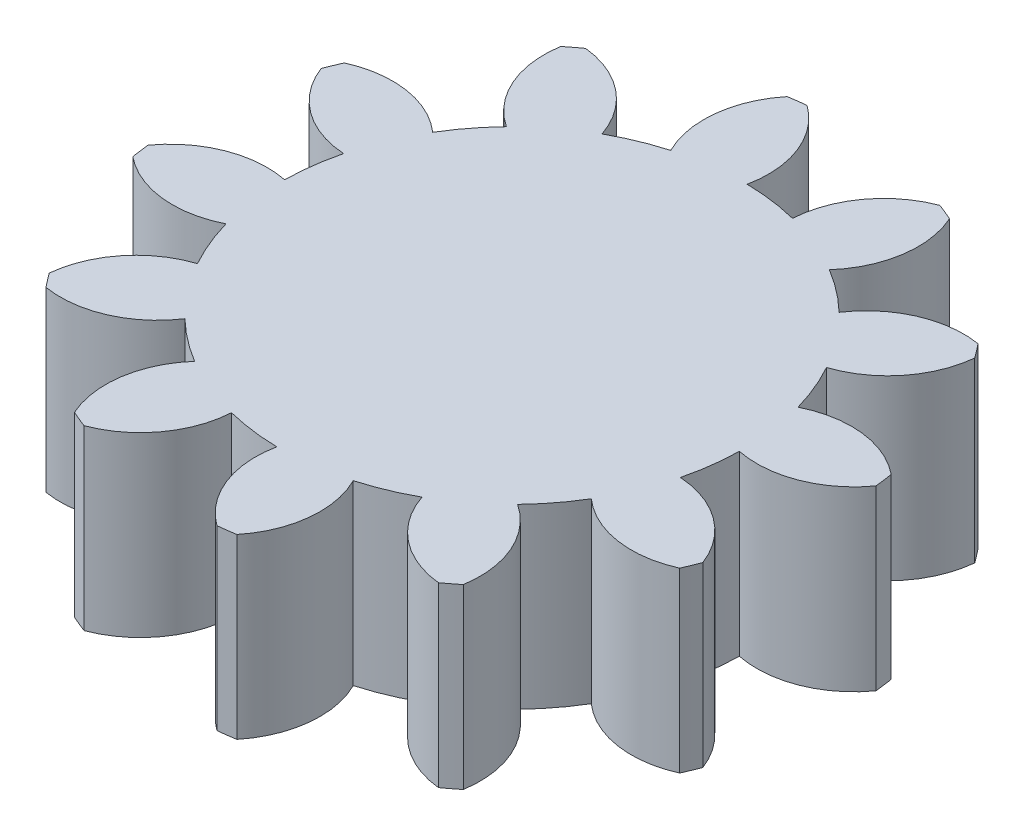
from build123d import *

# Parameters (mm, degrees)
SKETCH1_R                 = 5.6
BOSS_EXTRUDE1_DEPTH       = 3
CUT_EXTRUDE1_START        = -3
CUT_EXTRUDE1_DEPTH        = 3
CIRPATTERN1_COUNT         = 12
CIRPATTERN1_START         = -3
CIRPATTERN1_COPY_1_DEPTH  = 3
CIRPATTERN1_COPY_2_DEPTH  = 3
CIRPATTERN1_COPY_3_DEPTH  = 3
CIRPATTERN1_COPY_4_DEPTH  = 3
CIRPATTERN1_COPY_5_DEPTH  = 3
CIRPATTERN1_COPY_6_DEPTH  = 3
CIRPATTERN1_COPY_7_DEPTH  = 3
CIRPATTERN1_COPY_8_DEPTH  = 3
CIRPATTERN1_COPY_9_DEPTH  = 3
CIRPATTERN1_COPY_10_DEPTH = 3
CIRPATTERN1_COPY_11_DEPTH = 3


with BuildPart() as part:
    # Sketch1 → Boss-Extrude1 (new body)
    with BuildSketch(Plane(origin=(0, 0, 0), x_dir=(1, 0, 0), z_dir=(0, 1, 0))):
        with Locations(Location((0, 0, 0), (0, 0, 270))):
            Circle(SKETCH1_R)
    extrude(amount=BOSS_EXTRUDE1_DEPTH)

    # Sketch2 → Cut-Extrude1 (cut)
    with BuildSketch(Plane(origin=(0, 3, 0), x_dir=(1, 0, 0), z_dir=(0, 1, 0)).offset(CUT_EXTRUDE1_START)):
        with BuildLine():
            Line((0.510357412, 3.876549408), (0.730946676, 5.552091224))
            ThreePointArc((0.730946676, 5.552091224), (0.075009446, 5.599497619), (-0.581962275, 5.569678618))
            ThreePointArc((-0.581962275, 5.569678618), (-0.013232679, 4.835071359), (0.066186197, 3.909439779))
            ThreePointArc((0.066186197, 3.909439779), (0.288740502, 3.899324162), (0.510357412, 3.876549408))
        make_face()
    cut_extrude1 = extrude(amount=CUT_EXTRUDE1_DEPTH, mode=Mode.SUBTRACT)

    # Mirror1: Cut-Extrude1 across plane
    add(cut_extrude1.mirror(Plane(origin=(0, 0, 0), x_dir=(-0.13052619222004483, 0, 0.9914448613738113), z_dir=(-0.9914448613738114, 0, -0.13052619222004483))), mode=Mode.SUBTRACT)

    # CirPattern1: Cut-Extrude1 ×12 about axis
    cirpattern1_axis = Axis((0, 0, 0), (0, 1, 0))
    for i in range(1, CIRPATTERN1_COUNT):
        add(cut_extrude1.rotate(cirpattern1_axis, i * 360 / CIRPATTERN1_COUNT), mode=Mode.SUBTRACT)

    # CirPattern1 copy 1 sketch → CirPattern1 copy 1 (cut)
    with BuildSketch(Plane(origin=(0, 3, 0), x_dir=(-0.9659258262890651, 0, 0.25881904510253406), z_dir=(0, 1, 0)).offset(CIRPATTERN1_START)):
        with BuildLine():
            Line((0.510357412, -3.876549408), (0.730946676, -5.552091224))
            ThreePointArc((0.730946676, -5.552091224), (0.075009446, -5.599497619), (-0.581962275, -5.569678618))
            ThreePointArc((-0.581962275, -5.569678618), (-0.013232679, -4.835071359), (0.066186197, -3.909439779))
            ThreePointArc((0.066186197, -3.909439779), (0.288740502, -3.899324162), (0.510357412, -3.876549408))
        make_face()
    extrude(amount=CIRPATTERN1_COPY_1_DEPTH, mode=Mode.SUBTRACT)

    # CirPattern1 copy 2 sketch → CirPattern1 copy 2 (cut)
    with BuildSketch(Plane(origin=(0, 3, 0), x_dir=(-0.7071067811865381, 0, 0.7071067811865575), z_dir=(0, 1, 0)).offset(CIRPATTERN1_START)):
        with BuildLine():
            Line((0.510357412, -3.876549408), (0.730946676, -5.552091224))
            ThreePointArc((0.730946676, -5.552091224), (0.075009446, -5.599497619), (-0.581962275, -5.569678618))
            ThreePointArc((-0.581962275, -5.569678618), (-0.013232679, -4.835071359), (0.066186197, -3.909439779))
            ThreePointArc((0.066186197, -3.909439779), (0.288740502, -3.899324162), (0.510357412, -3.876549408))
        make_face()
    extrude(amount=CIRPATTERN1_COPY_2_DEPTH, mode=Mode.SUBTRACT)

    # CirPattern1 copy 3 sketch → CirPattern1 copy 3 (cut)
    with BuildSketch(Plane(origin=(0, 3, 0), x_dir=(-0.25881904510250764, 0, 0.9659258262890722), z_dir=(0, 1, 0)).offset(CIRPATTERN1_START)):
        with BuildLine():
            Line((0.510357412, -3.876549408), (0.730946676, -5.552091224))
            ThreePointArc((0.730946676, -5.552091224), (0.075009446, -5.599497619), (-0.581962275, -5.569678618))
            ThreePointArc((-0.581962275, -5.569678618), (-0.013232679, -4.835071359), (0.066186197, -3.909439779))
            ThreePointArc((0.066186197, -3.909439779), (0.288740502, -3.899324162), (0.510357412, -3.876549408))
        make_face()
    extrude(amount=CIRPATTERN1_COPY_3_DEPTH, mode=Mode.SUBTRACT)

    # CirPattern1 copy 4 sketch → CirPattern1 copy 4 (cut)
    with BuildSketch(Plane(origin=(0, 3, 0), x_dir=(0.2588190451025339, 0, 0.9659258262890651), z_dir=(0, 1, 0)).offset(CIRPATTERN1_START)):
        with BuildLine():
            Line((0.510357412, -3.876549408), (0.730946676, -5.552091224))
            ThreePointArc((0.730946676, -5.552091224), (0.075009446, -5.599497619), (-0.581962275, -5.569678618))
            ThreePointArc((-0.581962275, -5.569678618), (-0.013232679, -4.835071359), (0.066186197, -3.909439779))
            ThreePointArc((0.066186197, -3.909439779), (0.288740502, -3.899324162), (0.510357412, -3.876549408))
        make_face()
    extrude(amount=CIRPATTERN1_COPY_4_DEPTH, mode=Mode.SUBTRACT)

    # CirPattern1 copy 5 sketch → CirPattern1 copy 5 (cut)
    with BuildSketch(Plane(origin=(0, 3, 0), x_dir=(0.7071067811865577, 0, 0.707106781186538), z_dir=(0, 1, 0)).offset(CIRPATTERN1_START)):
        with BuildLine():
            Line((0.510357412, -3.876549408), (0.730946676, -5.552091224))
            ThreePointArc((0.730946676, -5.552091224), (0.075009446, -5.599497619), (-0.581962275, -5.569678618))
            ThreePointArc((-0.581962275, -5.569678618), (-0.013232679, -4.835071359), (0.066186197, -3.909439779))
            ThreePointArc((0.066186197, -3.909439779), (0.288740502, -3.899324162), (0.510357412, -3.876549408))
        make_face()
    extrude(amount=CIRPATTERN1_COPY_5_DEPTH, mode=Mode.SUBTRACT)

    # CirPattern1 copy 6 sketch → CirPattern1 copy 6 (cut)
    with BuildSketch(Plane(origin=(0, 3, 0), x_dir=(0.9659258262890722, 0, 0.2588190451025077), z_dir=(0, 1, 0)).offset(CIRPATTERN1_START)):
        with BuildLine():
            Line((0.510357412, -3.876549408), (0.730946676, -5.552091224))
            ThreePointArc((0.730946676, -5.552091224), (0.075009446, -5.599497619), (-0.581962275, -5.569678618))
            ThreePointArc((-0.581962275, -5.569678618), (-0.013232679, -4.835071359), (0.066186197, -3.909439779))
            ThreePointArc((0.066186197, -3.909439779), (0.288740502, -3.899324162), (0.510357412, -3.876549408))
        make_face()
    extrude(amount=CIRPATTERN1_COPY_6_DEPTH, mode=Mode.SUBTRACT)

    # CirPattern1 copy 7 sketch → CirPattern1 copy 7 (cut)
    with BuildSketch(Plane(origin=(0, 3, 0), x_dir=(0.9659258262890651, 0, -0.2588190451025343), z_dir=(0, 1, 0)).offset(CIRPATTERN1_START)):
        with BuildLine():
            Line((0.510357412, -3.876549408), (0.730946676, -5.552091224))
            ThreePointArc((0.730946676, -5.552091224), (0.075009446, -5.599497619), (-0.581962275, -5.569678618))
            ThreePointArc((-0.581962275, -5.569678618), (-0.013232679, -4.835071359), (0.066186197, -3.909439779))
            ThreePointArc((0.066186197, -3.909439779), (0.288740502, -3.899324162), (0.510357412, -3.876549408))
        make_face()
    extrude(amount=CIRPATTERN1_COPY_7_DEPTH, mode=Mode.SUBTRACT)

    # CirPattern1 copy 8 sketch → CirPattern1 copy 8 (cut)
    with BuildSketch(Plane(origin=(0, 3, 0), x_dir=(0.7071067811865385, 0, -0.7071067811865571), z_dir=(0, 1, 0)).offset(CIRPATTERN1_START)):
        with BuildLine():
            Line((0.510357412, -3.876549408), (0.730946676, -5.552091224))
            ThreePointArc((0.730946676, -5.552091224), (0.075009446, -5.599497619), (-0.581962275, -5.569678618))
            ThreePointArc((-0.581962275, -5.569678618), (-0.013232679, -4.835071359), (0.066186197, -3.909439779))
            ThreePointArc((0.066186197, -3.909439779), (0.288740502, -3.899324162), (0.510357412, -3.876549408))
        make_face()
    extrude(amount=CIRPATTERN1_COPY_8_DEPTH, mode=Mode.SUBTRACT)

    # CirPattern1 copy 9 sketch → CirPattern1 copy 9 (cut)
    with BuildSketch(Plane(origin=(0, 3, 0), x_dir=(0.25881904510250775, 0, -0.9659258262890722), z_dir=(0, 1, 0)).offset(CIRPATTERN1_START)):
        with BuildLine():
            Line((0.510357412, -3.876549408), (0.730946676, -5.552091224))
            ThreePointArc((0.730946676, -5.552091224), (0.075009446, -5.599497619), (-0.581962275, -5.569678618))
            ThreePointArc((-0.581962275, -5.569678618), (-0.013232679, -4.835071359), (0.066186197, -3.909439779))
            ThreePointArc((0.066186197, -3.909439779), (0.288740502, -3.899324162), (0.510357412, -3.876549408))
        make_face()
    extrude(amount=CIRPATTERN1_COPY_9_DEPTH, mode=Mode.SUBTRACT)

    # CirPattern1 copy 10 sketch → CirPattern1 copy 10 (cut)
    with BuildSketch(Plane(origin=(0, 3, 0), x_dir=(-0.2588190451025343, 0, -0.9659258262890651), z_dir=(0, 1, 0)).offset(CIRPATTERN1_START)):
        with BuildLine():
            Line((0.510357412, -3.876549408), (0.730946676, -5.552091224))
            ThreePointArc((0.730946676, -5.552091224), (0.075009446, -5.599497619), (-0.581962275, -5.569678618))
            ThreePointArc((-0.581962275, -5.569678618), (-0.013232679, -4.835071359), (0.066186197, -3.909439779))
            ThreePointArc((0.066186197, -3.909439779), (0.288740502, -3.899324162), (0.510357412, -3.876549408))
        make_face()
    extrude(amount=CIRPATTERN1_COPY_10_DEPTH, mode=Mode.SUBTRACT)

    # CirPattern1 copy 11 sketch → CirPattern1 copy 11 (cut)
    with BuildSketch(Plane(origin=(0, 3, 0), x_dir=(-0.7071067811865571, 0, -0.7071067811865385), z_dir=(0, 1, 0)).offset(CIRPATTERN1_START)):
        with BuildLine():
            Line((0.510357412, -3.876549408), (0.730946676, -5.552091224))
            ThreePointArc((0.730946676, -5.552091224), (0.075009446, -5.599497619), (-0.581962275, -5.569678618))
            ThreePointArc((-0.581962275, -5.569678618), (-0.013232679, -4.835071359), (0.066186197, -3.909439779))
            ThreePointArc((0.066186197, -3.909439779), (0.288740502, -3.899324162), (0.510357412, -3.876549408))
        make_face()
    extrude(amount=CIRPATTERN1_COPY_11_DEPTH, mode=Mode.SUBTRACT)


solid = part.part
